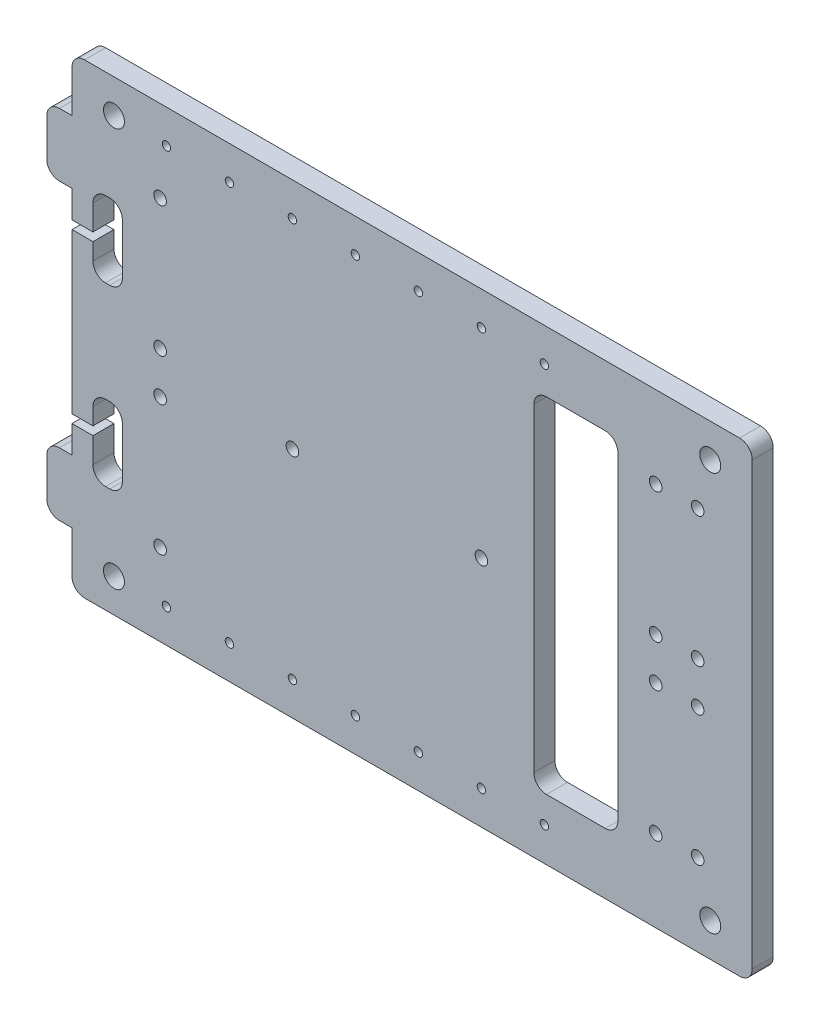
from build123d import *

# Parameters (mm, degrees)
SKETCH_1_W          = 162
SKETCH_1_H          = 111
EXTRUDE_1_DEPTH     = 5
CUT_EXTRUDE_1_REACH = 198.443
SKETCH_2_W          = 20
SKETCH_2_H          = 82
SKETCH_3_R          = 1.5
SKETCH_3_R_2        = 1
SKETCH_3_R_3        = 2.5
SKETCH_3_W          = 7
SKETCH_3_H          = 60
CUT_EXTRUDE_2_DEPTH = 5
FILLET_1_R          = 3
SKETCH1_W           = 5
SKETCH1_H           = 15
BOSS_EXTRUDE1_DEPTH = 6
SKETCH2_W           = 12
SKETCH2_H           = 24
BOSS_EXTRUDE2_DEPTH = 5
SKETCH3_W           = 5
SKETCH3_H           = 2
CUT_EXTRUDE2_DEPTH  = 197.443376065
FILLET1_R           = 3


with BuildPart() as part:
    # 草图1 → 凸台-拉伸1 (new body)
    with BuildSketch(Plane.XY):
        with Locations((81, -55.5)):
            Rectangle(SKETCH_1_W, SKETCH_1_H)
    extrude(amount=EXTRUDE_1_DEPTH)

    # 草图2 → 切除-拉伸1 (cut, up to next)
    with BuildSketch(Plane(origin=(0, 0, 0), x_dir=(-1, 0, 0), z_dir=(0, 0, -1)), mode=Mode.PRIVATE) as cut_extrude_1_sk1:
        with Locations((-120, -55.5)):
            Rectangle(SKETCH_2_W, SKETCH_2_H)
    cut_extrude_1_tool1 = extrude(cut_extrude_1_sk1.sketch, amount=-CUT_EXTRUDE_1_REACH, mode=Mode.PRIVATE) & part.part
    add(cut_extrude_1_tool1.solids().sort_by_distance((120, -55.5, 0))[0], mode=Mode.SUBTRACT)

    # 草图3 → 切除-拉伸2 (cut)
    with BuildSketch(Plane.XY.offset(5)):
        with Locations((149, -60.5)):
            Circle(SKETCH_3_R)
        with Locations((139, -60.5)):
            Circle(SKETCH_3_R)
        with Locations((149, -91.5)):
            Circle(SKETCH_3_R)
        with Locations((139, -91.5)):
            Circle(SKETCH_3_R)
        with Locations((149, -50.5)):
            Circle(SKETCH_3_R)
        with Locations((139, -50.5)):
            Circle(SKETCH_3_R)
        with Locations((22.5, -103)):
            Circle(SKETCH_3_R_2)
        with Locations((22.5, -8)):
            Circle(SKETCH_3_R_2)
        with Locations((21, -60.5)):
            Circle(SKETCH_3_R)
        with Locations((21, -91.5)):
            Circle(SKETCH_3_R)
        with Locations((21, -50.5)):
            Circle(SKETCH_3_R)
        with Locations((21, -19.5)):
            Circle(SKETCH_3_R)
        with Locations((10, -8)):
            Circle(SKETCH_3_R_3)
        with Locations((152, -8)):
            Circle(SKETCH_3_R_3)
        with Locations((152, -103)):
            Circle(SKETCH_3_R_3)
        with Locations((10, -103)):
            Circle(SKETCH_3_R_3)
        with Locations((37.5, -103)):
            Circle(SKETCH_3_R_2)
        with Locations((52.5, -103)):
            Circle(SKETCH_3_R_2)
        with Locations((67.5, -103)):
            Circle(SKETCH_3_R_2)
        with Locations((82.5, -103)):
            Circle(SKETCH_3_R_2)
        with Locations((97.5, -103)):
            Circle(SKETCH_3_R_2)
        with Locations((37.5, -8)):
            Circle(SKETCH_3_R_2)
        with Locations((52.5, -8)):
            Circle(SKETCH_3_R_2)
        with Locations((67.5, -8)):
            Circle(SKETCH_3_R_2)
        with Locations((82.5, -8)):
            Circle(SKETCH_3_R_2)
        with Locations((97.5, -8)):
            Circle(SKETCH_3_R_2)
        with Locations((112.5, -8)):
            Circle(SKETCH_3_R_2)
        with Locations((139, -19.5)):
            Circle(SKETCH_3_R)
        with Locations((149, -19.5)):
            Circle(SKETCH_3_R)
        with Locations((112.5, -103)):
            Circle(SKETCH_3_R_2)
        with Locations((52.5, -55.5)):
            Circle(SKETCH_3_R)
        with Locations((97.5, -55.5)):
            Circle(SKETCH_3_R)
        with Locations((8.5, -55.5)):
            Rectangle(SKETCH_3_W, SKETCH_3_H)
    extrude(amount=-CUT_EXTRUDE_2_DEPTH, mode=Mode.SUBTRACT)

    # 圆角1
    fillet_1_edges = [part.edges().sort_by_distance(p)[0] for p in [
        (5, -25.5, 2.5),
        (12, -25.5, 2.5),
        (12, -85.5, 2.5),
        (5, -85.5, 2.5),
        (110, -96.5, 2.5),
        (130, -96.5, 2.5),
        (130, -14.5, 2.5),
        (110, -14.5, 2.5),
        (0, 0, 2.5),
        (162, 0, 2.5),
        (162, -111, 2.5),
        (0, -111, 2.5),
    ]]
    fillet(fillet_1_edges, radius=FILLET_1_R)

    # Sketch1 → Boss-Extrude1 (add)
    with BuildSketch(Plane.ZY):
        with Locations((2.5, -90.5)):
            Rectangle(SKETCH1_W, SKETCH1_H)
        with Locations((2.5, -20.5)):
            Rectangle(SKETCH1_W, SKETCH1_H)
    extrude(amount=BOSS_EXTRUDE1_DEPTH)

    # Sketch2 → Boss-Extrude2 (add)
    with BuildSketch(Plane.XY):
        with Locations((6, -55.5)):
            Rectangle(SKETCH2_W, SKETCH2_H)
    extrude(amount=BOSS_EXTRUDE2_DEPTH)

    # Sketch3 → Cut-Extrude2 (cut, through all)
    with BuildSketch(Plane.XY):
        with Locations((2.5, -35.5)):
            Rectangle(SKETCH3_W, SKETCH3_H)
        with Locations((2.5, -75.5)):
            Rectangle(SKETCH3_W, SKETCH3_H)
    extrude(amount=CUT_EXTRUDE2_DEPTH, mode=Mode.SUBTRACT)

    # Fillet1
    fillet1_edges = [part.edges().sort_by_distance(p)[0] for p in [
        (-6, -13, 2.5),
        (-6, -28, 2.5),
        (-6, -98, 2.5),
        (-6, -83, 2.5),
        (5, -67.5, 2.5),
        (5, -43.5, 2.5),
        (12, -43.5, 2.5),
        (12, -67.5, 2.5),
    ]]
    fillet(fillet1_edges, radius=FILLET1_R)


solid = part.part
